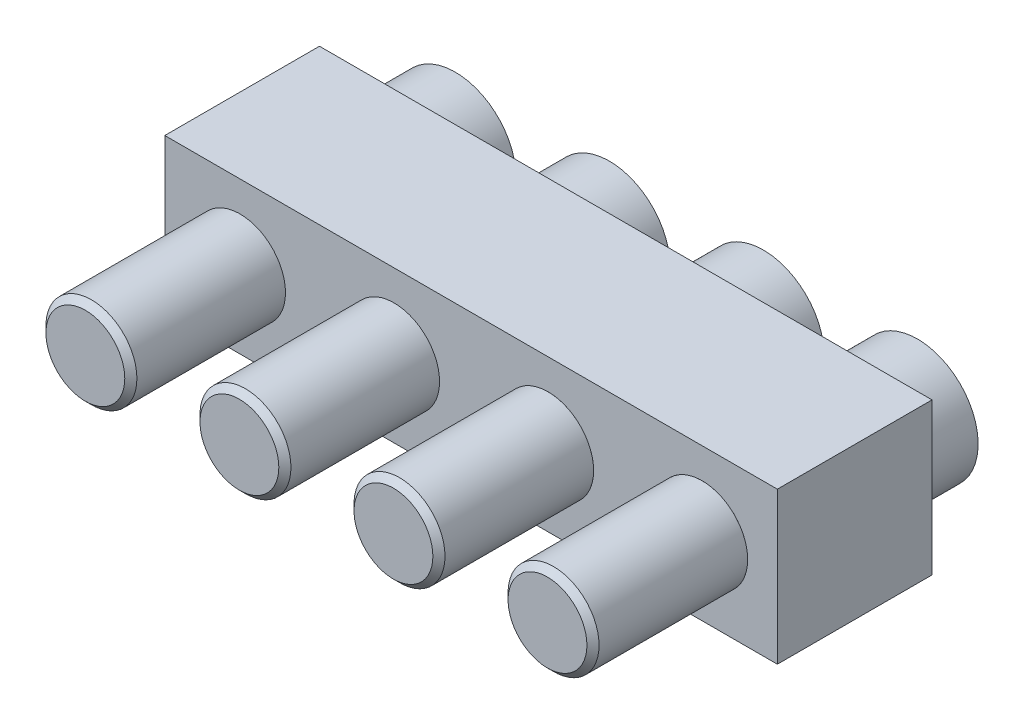
from build123d import *

# Parameters (mm, degrees)
SKETCH_1_W        = 10.1
SKETCH_1_H        = 2.5
SKETCH_1_R        = 0.75
EXTRUDE_1_DEPTH   = 2.55
SKETCH_2_R        = 1
EXTRUDE_2_DEPTH   = 1
SKETCH_3_R        = 0.75
EXTRUDE_3_DEPTH   = 2.55
EXTRUDE_3_2_DEPTH = 2.55
EXTRUDE_3_3_DEPTH = 2.55
EXTRUDE_3_4_DEPTH = 2.55
CHAMFER_1_SIZE    = 0.1
CHAMFER_2_SIZE    = 0.1
CHAMFER_3_SIZE    = 0.1
CHAMFER_4_SIZE    = 0.1


with BuildPart() as part:
    # 草图1 → 凸台-拉伸1 (new body)
    with BuildSketch(Plane.XY):
        with Locations((5.05, 1.25)):
            Rectangle(SKETCH_1_W, SKETCH_1_H)
        with Locations((3.78, 1.25)):
            Circle(SKETCH_1_R, mode=Mode.SUBTRACT)
        with Locations((1.24, 1.25)):
            Circle(SKETCH_1_R, mode=Mode.SUBTRACT)
        with Locations(Location((8.86, 1.25, 0), (0, 0, 180))):
            Circle(SKETCH_1_R, mode=Mode.SUBTRACT)
        with Locations(Location((6.32, 1.25, 0), (0, 0, 180))):
            Circle(SKETCH_1_R, mode=Mode.SUBTRACT)
    extrude(amount=EXTRUDE_1_DEPTH)

    # 草图2 → 凸台-拉伸2 (add)
    with BuildSketch(Plane(origin=(0, 0, 0), x_dir=(-1, 0, 0), z_dir=(0, 0, -1))):
        with Locations((-6.32, 1.25)):
            Circle(SKETCH_2_R)
        with Locations((-8.86, 1.25)):
            Circle(SKETCH_2_R)
        with Locations(Location((-3.78, 1.25, 0), (0, 0, 180))):
            Circle(SKETCH_2_R)
        with Locations(Location((-1.24, 1.25, 0), (0, 0, 180))):
            Circle(SKETCH_2_R)
    extrude(amount=EXTRUDE_2_DEPTH)


with BuildPart() as body_2:
    # 草图3 → 凸台-拉伸3 (new body)
    with BuildSketch(Plane.XY.offset(2.55)):
        with Locations((3.78, 1.25)):
            Circle(SKETCH_3_R)
    extrude(amount=EXTRUDE_3_DEPTH)

    # 倒角3
    chamfer_3_edges = [body_2.edges().sort_by_distance(p)[0] for p in [
        (3.03, 1.25, 5.1),
    ]]
    chamfer(chamfer_3_edges, length=CHAMFER_3_SIZE)


with BuildPart() as body_3:
    # 草图3 → Extrude 3 2 (new body)
    with BuildSketch(Plane.XY.offset(2.55)):
        with Locations((1.24, 1.25)):
            Circle(SKETCH_3_R)
    extrude(amount=EXTRUDE_3_2_DEPTH)

    # 倒角4
    chamfer_4_edges = [body_3.edges().sort_by_distance(p)[0] for p in [
        (0.49, 1.25, 5.1),
    ]]
    chamfer(chamfer_4_edges, length=CHAMFER_4_SIZE)


with BuildPart() as body_4:
    # 草图3 → Extrude 3 3 (new body)
    with BuildSketch(Plane.XY.offset(2.55)):
        with Locations((6.32, 1.25)):
            Circle(SKETCH_3_R)
    extrude(amount=EXTRUDE_3_3_DEPTH)

    # 倒角2
    chamfer_2_edges = [body_4.edges().sort_by_distance(p)[0] for p in [
        (5.57, 1.25, 5.1),
    ]]
    chamfer(chamfer_2_edges, length=CHAMFER_2_SIZE)


with BuildPart() as body_5:
    # 草图3 → Extrude 3 4 (new body)
    with BuildSketch(Plane.XY.offset(2.55)):
        with Locations((8.86, 1.25)):
            Circle(SKETCH_3_R)
    extrude(amount=EXTRUDE_3_4_DEPTH)

    # 倒角1
    chamfer_1_edges = [body_5.edges().sort_by_distance(p)[0] for p in [
        (8.11, 1.25, 5.1),
    ]]
    chamfer(chamfer_1_edges, length=CHAMFER_1_SIZE)


solid = Compound([part.part, body_2.part, body_3.part, body_4.part, body_5.part])
